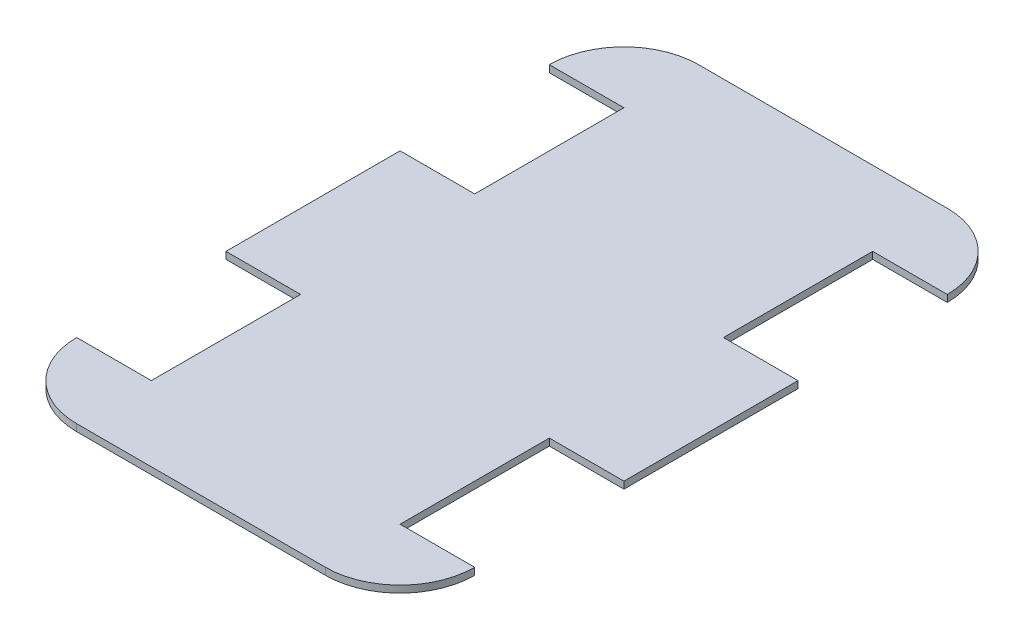
from build123d import *

# Parameters (mm, degrees)
BOSS_EXTRUDE1_DEPTH = 2.8


with BuildPart() as part:
    # Sketch1 → Boss-Extrude1 (new body)
    with BuildSketch(Plane(origin=(0, 0, 0), x_dir=(1, 0, 0), z_dir=(0, 1, 0))):
        with BuildLine():
            Line((0, 30), (30, 30))
            Line((30, 30), (30, 90))
            Line((30, 90), (0, 90))
            Line((0, 90), (0, 160))
            Line((0, 160), (30, 160))
            Line((30, 160), (30, 220))
            Line((30, 220), (0, 220))
            ThreePointArc((0, 220), (8.786796564, 241.213203436), (30, 250))
            Line((30, 250), (130, 250))
            ThreePointArc((130, 250), (151.213203436, 241.213203436), (160, 220))
            Line((160, 220), (130, 220))
            Line((130, 220), (130, 160))
            Line((130, 160), (160, 160))
            Line((160, 160), (160, 90))
            Line((160, 90), (130, 90))
            Line((130, 90), (130, 30))
            Line((130, 30), (160, 30))
            ThreePointArc((160, 30), (151.213203436, 8.786796564), (130, 0))
            Line((130, 0), (30, 0))
            ThreePointArc((30, 0), (8.786796564, 8.786796564), (0, 30))
        make_face()
    extrude(amount=BOSS_EXTRUDE1_DEPTH)


solid = part.part
